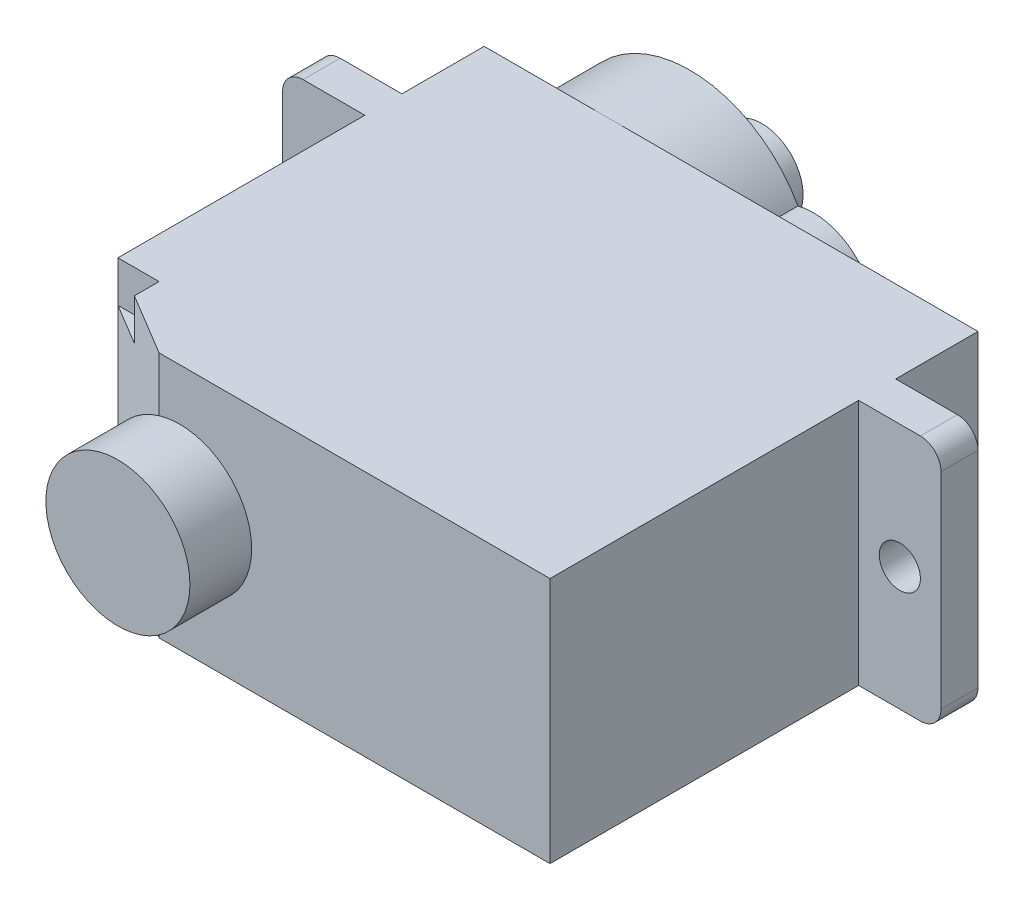
from build123d import *

# Parameters (mm, degrees)
SKETCH_1_W          = 24
SKETCH_1_H          = 12
EXTRUDE_1_DEPTH     = 12
SKETCH_2_R          = 1
EXTRUDE_2_DEPTH     = 1.8
SKETCH_3_W          = 24
SKETCH_3_H          = 12
EXTRUDE_3_DEPTH     = 4
EXTRUDE_4_DEPTH     = 4
SKETCH_5_R          = 2
EXTRUDE_5_DEPTH     = 3.5
EXTRUDE_6_DEPTH     = 3
CUT_EXTRUDE_1_DEPTH = 12
SKETCH_9_R          = 3.5
EXTRUDE_7_DEPTH     = 3


with BuildPart() as part:
    # Эскиз1 → Бобышка-Вытянуть1 (new body)
    with BuildSketch(Plane.XY):
        Rectangle(SKETCH_1_W, SKETCH_1_H)
    extrude(amount=EXTRUDE_1_DEPTH)

    # Эскиз2 → Бобышка-Вытянуть2 (add)
    with BuildSketch(Plane(origin=(0, 0, 0), x_dir=(-1, 0, 0), z_dir=(0, 0, -1))):
        with BuildLine():
            Line((12, 6), (15, 6))
            ThreePointArc((15, 6), (15.707106781, 5.707106781), (16, 5))
            Line((16, 5), (16, -5))
            ThreePointArc((16, -5), (15.707106781, -5.707106781), (15, -6))
            Line((15, -6), (12, -6))
            Line((12, -6), (-12, -6))
            Line((-12, -6), (-15, -6))
            ThreePointArc((-15, -6), (-15.707106781, -5.707106781), (-16, -5))
            Line((-16, -5), (-16, 5))
            ThreePointArc((-16, 5), (-15.707106781, 5.707106781), (-15, 6))
            Line((-15, 6), (-12, 6))
            Line((-12, 6), (12, 6))
        make_face()
        with Locations((14, 0)):
            Circle(SKETCH_2_R, mode=Mode.SUBTRACT)
        with Locations((-14, 0)):
            Circle(SKETCH_2_R, mode=Mode.SUBTRACT)
    extrude(amount=EXTRUDE_2_DEPTH)

    # Эскиз3 → Бобышка-Вытянуть3 (add)
    with BuildSketch(Plane(origin=(0, 0, -1.8), x_dir=(-1, 0, 0), z_dir=(0, 0, -1))):
        Rectangle(SKETCH_3_W, SKETCH_3_H)
    extrude(amount=EXTRUDE_3_DEPTH)

    # Эскиз4 → Бобышка-Вытянуть4 (add)
    with BuildSketch(Plane(origin=(0, 0, -5.8), x_dir=(-1, 0, 0), z_dir=(0, 0, -1))):
        with BuildLine():
            ThreePointArc((0.75, 2.90473751), (12, 0), (0.75, -2.90473751))
            ThreePointArc((0.75, -2.90473751), (-3, 0), (0.75, 2.90473751))
        make_face()
    extrude(amount=EXTRUDE_4_DEPTH)

    # Эскиз5 → Бобышка-Вытянуть5 (add)
    with BuildSketch(Plane(origin=(0, 0, -9.8), x_dir=(-1, 0, 0), z_dir=(0, 0, -1))):
        with Locations((6, 0)):
            Circle(SKETCH_5_R)
    extrude(amount=EXTRUDE_5_DEPTH)

    # Эскиз6 → Бобышка-Вытянуть6 (add)
    with BuildSketch(Plane.XY.offset(12)):
        Polygon((12, -6), (12, 6), (-10, 6), (-10, 4), (-12, 4), (-12, -4), (-10, -4), (-10, -6), align=None)
    extrude(amount=EXTRUDE_6_DEPTH)

    # Эскиз8 → Вырез-Вытянуть1 (cut)
    with BuildSketch(Plane(origin=(0, 6, 0), x_dir=(1, 0, 0), z_dir=(0, 1, 0))):
        Polygon((-7, -15), (-12, -12), (-12, -15), align=None)
    extrude(amount=-CUT_EXTRUDE_1_DEPTH, mode=Mode.SUBTRACT)

    # Эскиз9 → Бобышка-Вытянуть7 (add)
    with BuildSketch(Plane.XY.offset(15)):
        with Locations(Location((-6, 0, 0), (0, 0, 253.398450401))):
            Circle(SKETCH_9_R)
    extrude(amount=EXTRUDE_7_DEPTH)


solid = part.part
